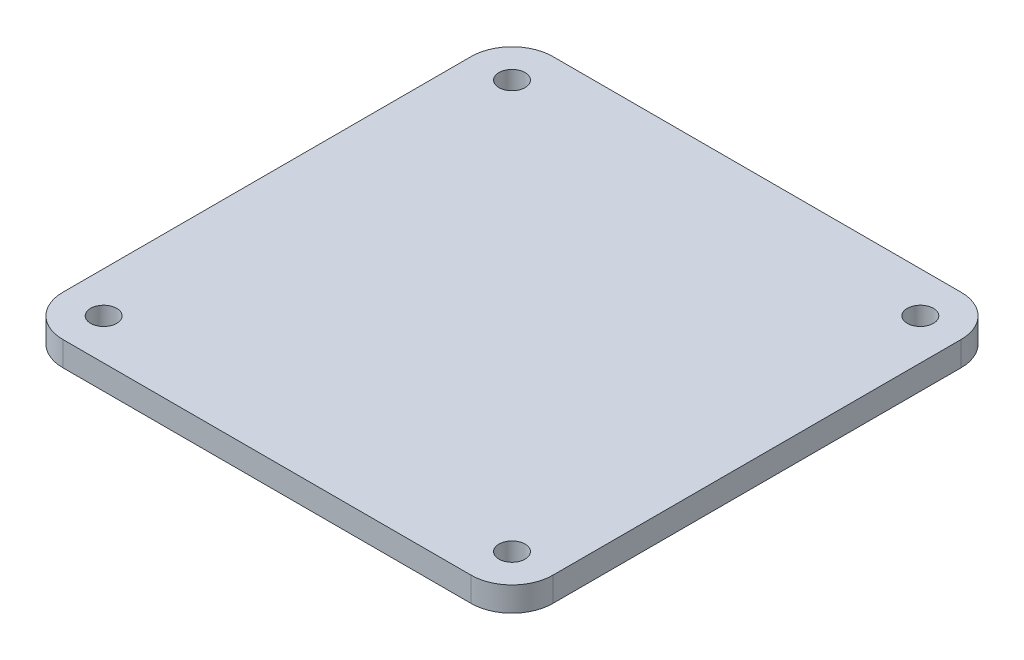
from build123d import *

# Parameters (mm, degrees)
SKETCH1_R           = 1.6
BOSS_EXTRUDE1_DEPTH = 3


with BuildPart() as part:
    # Sketch1 → Boss-Extrude1 (new body)
    with BuildSketch(Plane(origin=(0, 4.2575, 0), x_dir=(1, 0, 0), z_dir=(0, 1, 0))):
        with BuildLine():
            Line((-30, 25), (-30, -25))
            ThreePointArc((-30, -25), (-28.535533906, -28.535533906), (-25, -30))
            Line((-25, -30), (25, -30))
            ThreePointArc((25, -30), (28.535533906, -28.535533906), (30, -25))
            Line((30, -25), (30, 25))
            ThreePointArc((30, 25), (28.535533906, 28.535533906), (25, 30))
            Line((25, 30), (-25, 30))
            ThreePointArc((-25, 30), (-28.535533906, 28.535533906), (-30, 25))
        make_face()
        with Locations(Location((25, 25, 0), (0, 0, 270))):
            Circle(SKETCH1_R, mode=Mode.SUBTRACT)
        with Locations(Location((-25, 25, 0), (0, 0, 270))):
            Circle(SKETCH1_R, mode=Mode.SUBTRACT)
        with Locations(Location((-25, -25, 0), (0, 0, 270))):
            Circle(SKETCH1_R, mode=Mode.SUBTRACT)
        with Locations(Location((25, -25, 0), (0, 0, 270))):
            Circle(SKETCH1_R, mode=Mode.SUBTRACT)
    extrude(amount=BOSS_EXTRUDE1_DEPTH)


solid = part.part
